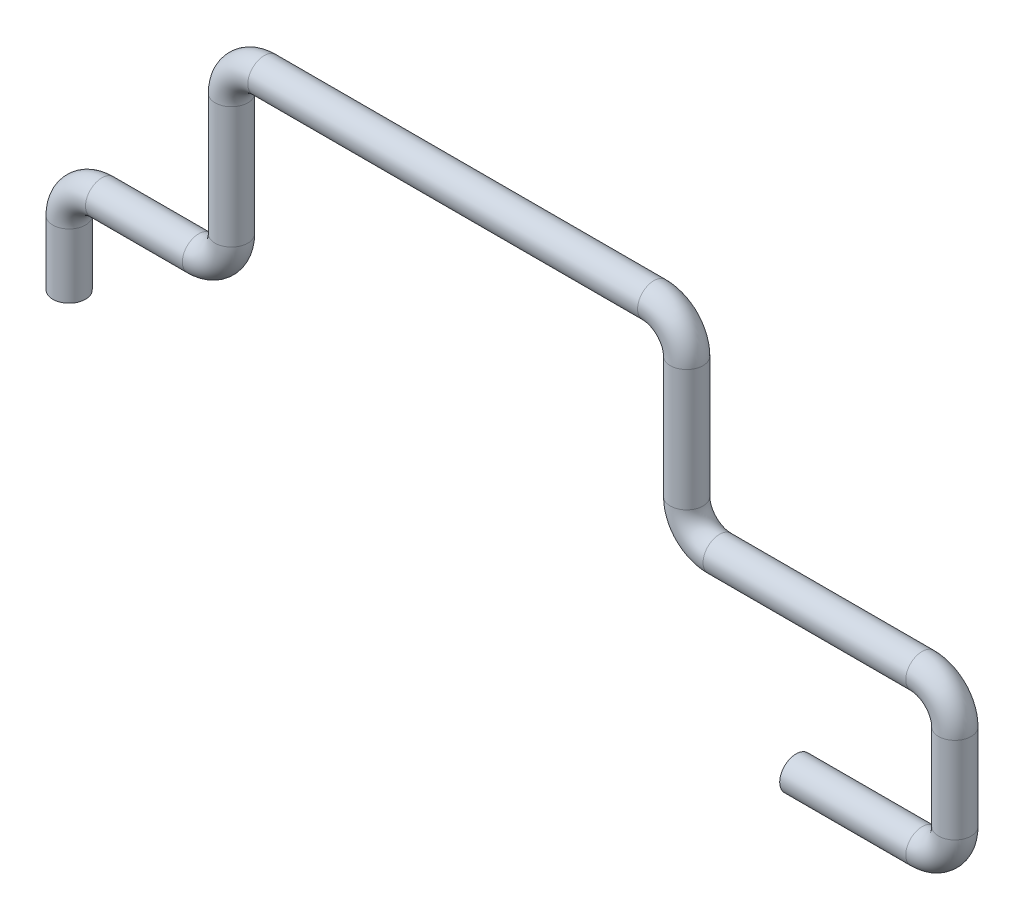
from build123d import *

# Parameters (mm, degrees)
BARRER4_PROFILE_R = 2.5
VACIADO2_T        = -0.01


with BuildPart() as part:
    # Barrer4: sweep along a path in Croquis1
    with BuildLine(Plane.XY) as barrer4_path:
        Line((0, 0), (0, 9.820088473))
        ThreePointArc((0, 9.820088473), (1.464466094, 13.355622378), (5, 14.820088473))
        Line((5, 14.820088473), (19.789966172, 14.820088473))
        ThreePointArc((19.789966172, 14.820088473), (23.325500078, 16.284554567), (24.789966172, 19.820088473))
        Line((24.789966172, 19.820088473), (24.789966172, 38.382440801))
        ThreePointArc((24.789966172, 38.382440801), (26.254432266, 41.917974707), (29.789966172, 43.382440801))
        Line((29.789966172, 43.382440801), (89.309653916, 43.382440801))
        ThreePointArc((89.309653916, 43.382440801), (92.845187822, 41.917974707), (94.309653916, 38.382440801))
        Line((94.309653916, 38.382440801), (94.309653916, 19.820088473))
        ThreePointArc((94.309653916, 19.820088473), (95.77412001, 16.284554567), (99.309653916, 14.820088473))
        Line((99.309653916, 14.820088473), (130.266989331, 14.820088473))
        ThreePointArc((130.266989331, 14.820088473), (133.802523237, 13.355622378), (135.266989331, 9.820088473))
        Line((135.266989331, 9.820088473), (135.266989331, -3.353140775))
        ThreePointArc((135.266989331, -3.353140775), (133.802523237, -6.888674681), (130.266989331, -8.353140775))
        Line((130.266989331, -8.353140775), (111.015935467, -8.353140775))
    # Barrer4 profile (on start of the path) → Barrer4 (sweep)
    with BuildSketch(Plane.ZX):
        Circle(BARRER4_PROFILE_R)
    sweep(path=barrer4_path.line)

    # Vaciado2
    vaciado2_openings = [part.faces().sort_by_distance(p)[0] for p in [
        (111.015935467, -8.353140775, 0),
        (0, 0, 0),
    ]]
    offset(amount=VACIADO2_T, openings=vaciado2_openings, kind=Kind.INTERSECTION)


solid = part.part
